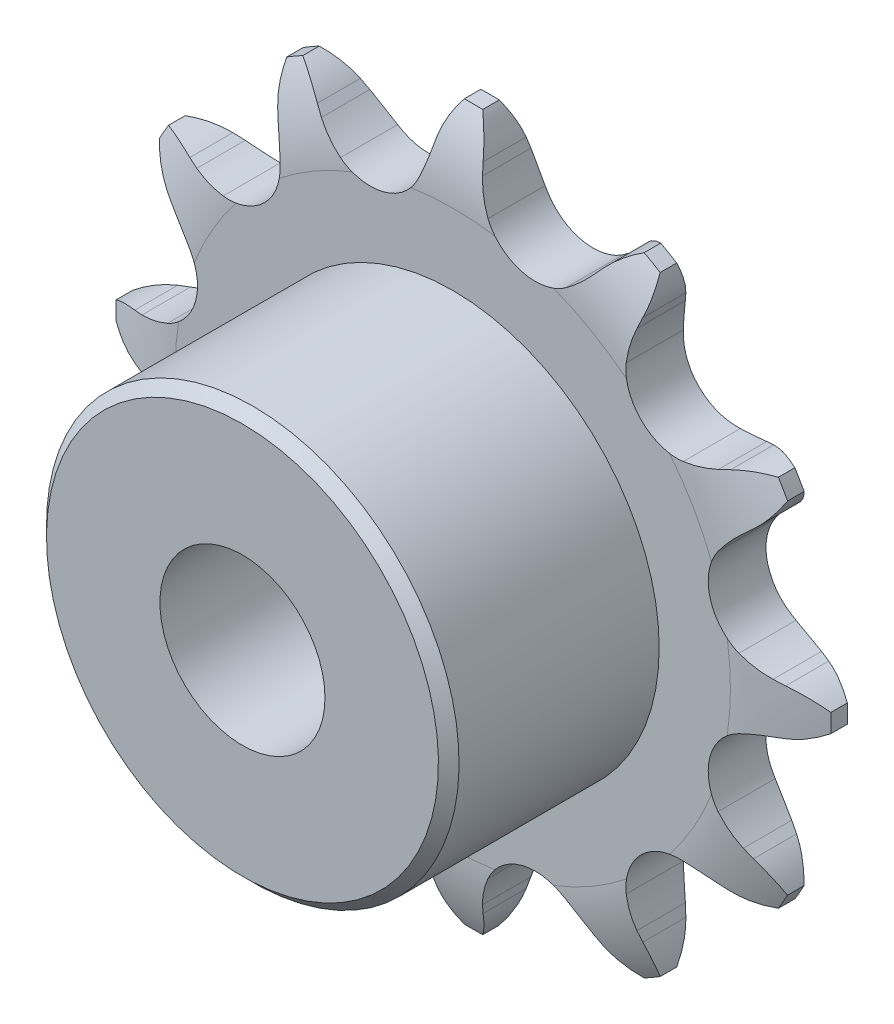
from build123d import *

# Parameters (mm, degrees)
CUT_EXTRUDE1_DEPTH      = 25.545738008
CIRPATTERN1_COUNT       = 12
BOSS_EXTRUDE1_START     = 1.4
SKETCH2_R               = 10
BOSS_EXTRUDE1_DEPTH     = 10.2
CUT_EXTRUDE2_DEPTH      = 28.112603367
CUT_EXTRUDE2_DEPTH_BACK = 28.112603367
SKETCH3_R               = 4
SKETCH4_W               = 2.1
SKETCH4_H               = 7.173390009


with BuildPart() as part:
    # Sketch1 → Revolve1 (revolve)
    with BuildSketch(Plane(origin=(0, 0, 0), x_dir=(0, 0, -1), z_dir=(1, 0, 0))):
        with BuildLine():
            Line((1.4, 0), (-1.4, 0))
            Line((-1.4, 0), (-1.4, 13.455219884))
            ThreePointArc((-1.4, 13.455219884), (-1.145966692, 15.455219884), (-0.4, 17.32820323))
            Line((-0.4, 17.32820323), (0.4, 17.32820323))
            ThreePointArc((0.4, 17.32820323), (1.145966692, 15.455219884), (1.4, 13.455219884))
            Line((1.4, 13.455219884), (1.4, 0))
        make_face()
    revolve(axis=Axis((0, 0, -1.4), (0, 0, 1)))

    # Sketch0 → Cut-Extrude1 (cut, symmetric)
    with BuildSketch(Plane.XY):
        with BuildLine():
            Line((6.926940619, -14.218327436), (6.599156686, -13.84999961))
            ThreePointArc((6.599156686, -13.84999961), (6.060506052, -13.311348976), (5.462964059, -12.838874026))
            ThreePointArc((5.462964059, -12.838874026), (3.339856144, -12.464512818), (1.688371358, -13.850273092))
            ThreePointArc((1.688371358, -13.850273092), (1.407122287, -14.558219398), (1.209962471, -15.294029848))
            Line((1.209962471, -15.294029848), (1.110257171, -15.776903068))
            ThreePointArc((1.110257171, -15.776903068), (-0.68444399, -18.428589751), (-3.826897653, -19.042901968))
            ThreePointArc((-3.826897653, -19.042901968), (5.027204427, -18.761782342), (12.835641569, -14.57818804))
            ThreePointArc((12.835641569, -14.57818804), (9.807040758, -15.617404885), (6.926940619, -14.218327436))
        make_face()
    cut_extrude1 = extrude(amount=CUT_EXTRUDE1_DEPTH, both=True, mode=Mode.SUBTRACT)

    # CirPattern1: Cut-Extrude1 ×12 about axis
    cirpattern1_axis = Axis((0, 0, 0), (0, 0, 1))
    for i in range(1, CIRPATTERN1_COUNT):
        add(cut_extrude1.rotate(cirpattern1_axis, i * 360 / CIRPATTERN1_COUNT), mode=Mode.SUBTRACT)

    # Sketch2 → Boss-Extrude1 (add)
    with BuildSketch(Plane.XY.offset(BOSS_EXTRUDE1_START)):
        with Locations(Location((0, 0, 0), (0, 0, 270))):
            Circle(SKETCH2_R)
    extrude(amount=BOSS_EXTRUDE1_DEPTH)

    # Sketch3 → Cut-Extrude2 (cut, two sides: drawn at the far end of the back side and taken through both)
    with BuildSketch(Plane.XY.offset(-CUT_EXTRUDE2_DEPTH_BACK)):
        Circle(SKETCH3_R)
    extrude(amount=CUT_EXTRUDE2_DEPTH + CUT_EXTRUDE2_DEPTH_BACK, mode=Mode.SUBTRACT)

    # Sketch4 → Cut-Revolve1 (revolve, cut)
    with BuildSketch(Plane(origin=(0, 0, 0), x_dir=(0, 0, -1), z_dir=(1, 0, 0))):
        Polygon((-11.6, 10), (-11.6, 9.5), (-11.1, 10), align=None)
        with Locations((-2.45, 13.741508226)):
            Rectangle(SKETCH4_W, SKETCH4_H)
    revolve(axis=Axis((0, 0, -1.4), (0, 0, 1)), mode=Mode.SUBTRACT)


solid = part.part
